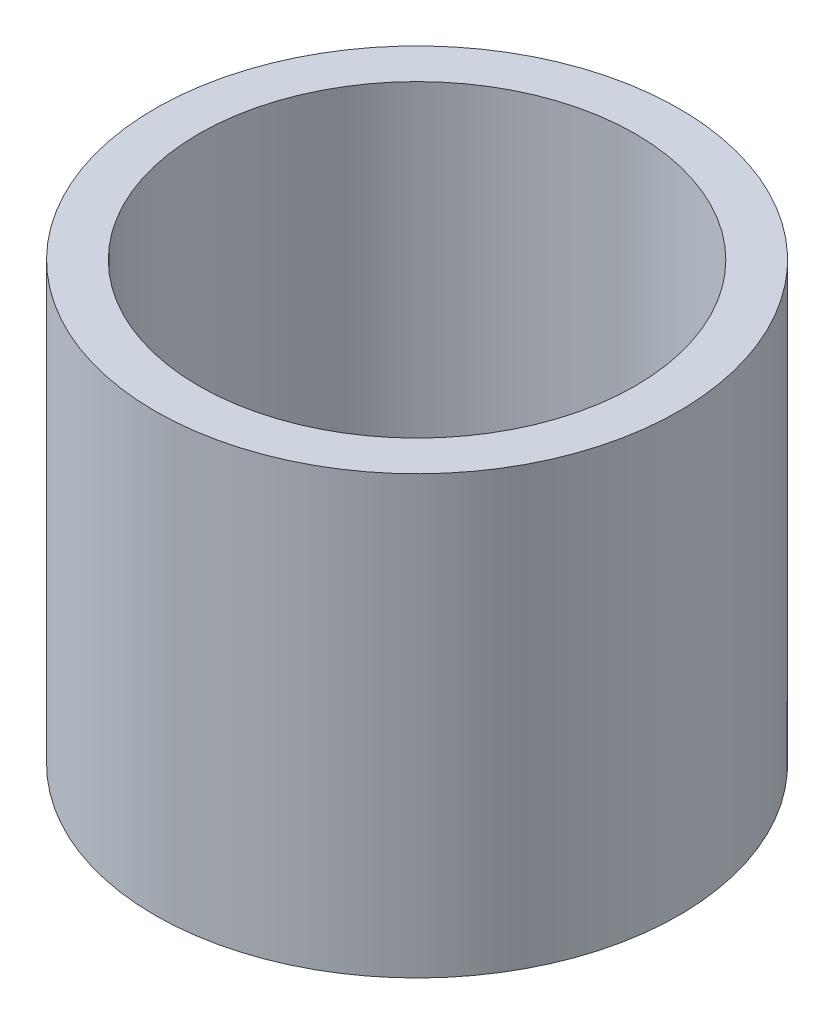
from build123d import *

# Parameters (mm, degrees)
SKETCH1_R           = 30
SKETCH1_R_2         = 25
BOSS_EXTRUDE1_DEPTH = 25
SKETCH3_R           = 25
BOSS_EXTRUDE2_DEPTH = 10


with BuildPart() as part:
    # Sketch1 → Boss-Extrude1 (new, symmetric)
    with BuildSketch(Plane(origin=(0, 0, 0), x_dir=(1, 0, 0), z_dir=(0, 1, 0))):
        with Locations(Location((0, 0, 0), (0, 0, 270))):
            Circle(SKETCH1_R)
        with Locations(Location((0, 0, 0), (0, 0, 270))):
            Circle(SKETCH1_R_2, mode=Mode.SUBTRACT)
    extrude(amount=BOSS_EXTRUDE1_DEPTH, both=True)

    # Sketch3 → Boss-Extrude2 (add)
    with BuildSketch(Plane.XZ.offset(25)):
        with Locations(Location((0, 0, 0), (0, 0, 270))):
            Circle(SKETCH3_R)
    extrude(amount=-BOSS_EXTRUDE2_DEPTH)


solid = part.part
